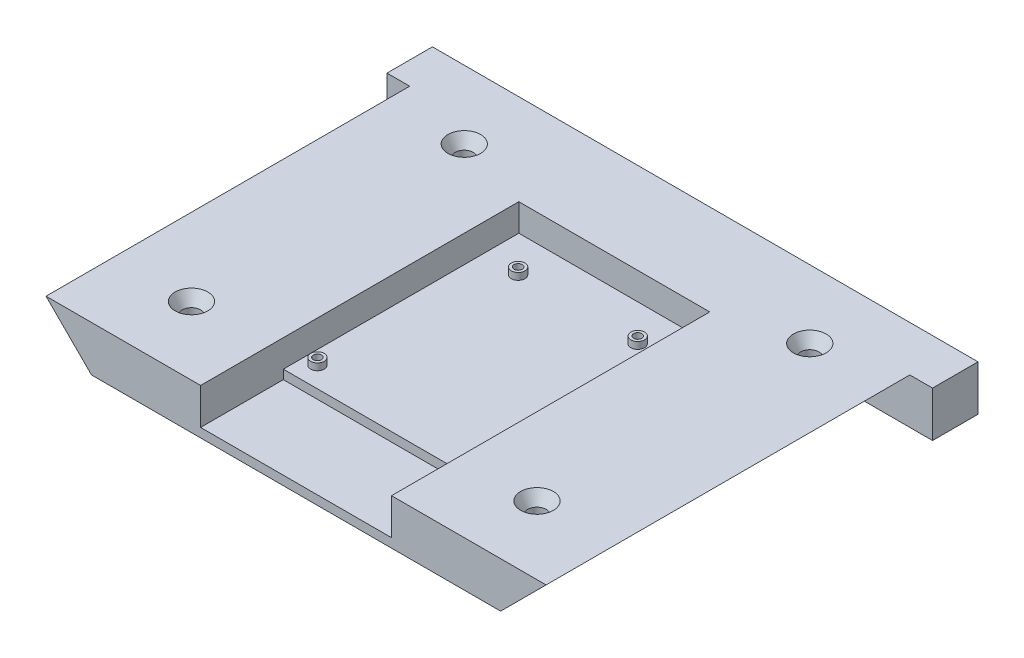
from build123d import *

# Parameters (mm, degrees)
SKETCH1_W                       = 120
SKETCH1_H                       = 90
BODY_DEPTH                      = 10
LEFT_CUT_DEPTH                  = 80
SKETCH5_W                       = 42
SKETCH5_H                       = 70
RFID_ROOM_DEPTH                 = 6
SKETCH12_R                      = 1.5
OUTER_SCREW_HOLE_RFID_DEPTH     = 1.5
SKETCH14_R                      = 0.9
INNER_SCREW_HOLE_RFID_DEPTH     = 3
RFID_UPPER_CUT_DEPTH            = 2
SKETCH17_R                      = 0.9
INNER_SCREW_CUT_DOWN_DEPTH      = 1.5
SKETCH6_R                       = 3.6
OUTER_HOLE_UP_DEPTH             = 2.6
OUTER_HOLE_UP_DRAFT             = -31.607502246
OUTER_HOLE_UP_PROFILE_2_DEPTH   = 2.6
OUTER_HOLE_UP_PROFILE_2_DRAFT   = -31.607502246
OUTER_HOLE_UP_PROFILE_3_DEPTH   = 2.6
OUTER_HOLE_UP_PROFILE_3_DRAFT   = -31.607502246
OUTER_HOLE_UP_PROFILE_4_DEPTH   = 2.6
OUTER_HOLE_UP_PROFILE_4_DRAFT   = -31.607502246
SKETCH7_R                       = 2
INNER_HOLE_DEPTH                = 76.364182474
SKETCH11_R                      = 3.6
OUTER_HOLE_DOWN_DEPTH           = 2.6
OUTER_HOLE_DOWN_DRAFT           = -31.607502246
OUTER_HOLE_DOWN_PROFILE_2_DEPTH = 2.6
OUTER_HOLE_DOWN_PROFILE_2_DRAFT = -31.607502246
OUTER_HOLE_DOWN_PROFILE_3_DEPTH = 2.6
OUTER_HOLE_DOWN_PROFILE_3_DRAFT = -31.607502246
OUTER_HOLE_DOWN_PROFILE_4_DEPTH = 2.6
OUTER_HOLE_DOWN_PROFILE_4_DRAFT = -31.607502246
LOGO_DEPTH                      = 2


with BuildPart() as part:
    # Sketch1 → body (new body)
    with BuildSketch(Plane(origin=(0, 0, 0), x_dir=(1, 0, 0), z_dir=(0, 1, 0))):
        Rectangle(SKETCH1_W, SKETCH1_H)
    extrude(amount=BODY_DEPTH)

    # Sketch4 → left cut (cut)
    with BuildSketch(Plane.XY.offset(45)):
        Polygon((-60, 10), (-60, 0), (-45, 0), (-55, 10), align=None)
    left_cut = extrude(amount=-LEFT_CUT_DEPTH, mode=Mode.SUBTRACT)

    # right cut(mirror): left cut across plane
    add(left_cut.mirror(Plane(origin=(0, 0, 0), x_dir=(0, 0, 1), z_dir=(1, 0, 0))), mode=Mode.SUBTRACT)

    # Sketch5 → rfid room (cut)
    with BuildSketch(Plane(origin=(0, 10, 0), x_dir=(1, 0, 0), z_dir=(0, 1, 0))):
        with Locations((0, -10)):
            Rectangle(SKETCH5_W, SKETCH5_H)
    extrude(amount=-RFID_ROOM_DEPTH, mode=Mode.SUBTRACT)

    # Sketch12 → outer screw hole rfid (add)
    with BuildSketch(Plane(origin=(0, 4, 0), x_dir=(1, 0, 0), z_dir=(0, 1, 0))):
        with Locations(Location((-13.15, 17, 0), (0, 0, 90))):
            Circle(SKETCH12_R)
        with Locations(Location((13.15, 17, 0), (0, 0, 90))):
            Circle(SKETCH12_R)
        with Locations(Location((-18, -22.3, 0), (0, 0, 90))):
            Circle(SKETCH12_R)
        with Locations(Location((18, -22.3, 0), (0, 0, 90))):
            Circle(SKETCH12_R)
    extrude(amount=OUTER_SCREW_HOLE_RFID_DEPTH)

    # Sketch14 → inner screw hole rfid (cut)
    with BuildSketch(Plane(origin=(0, 5.5, 0), x_dir=(1, 0, 0), z_dir=(0, 1, 0))):
        with Locations(Location((18, -22.3, 0), (0, 0, 270))):
            Circle(SKETCH14_R)
        with Locations(Location((-18, -22.3, 0), (0, 0, 270))):
            Circle(SKETCH14_R)
    extrude(amount=-INNER_SCREW_HOLE_RFID_DEPTH, mode=Mode.SUBTRACT)

    # Sketch15 → rfid upper cut (cut)
    with BuildSketch(Plane(origin=(0, 4, 0), x_dir=(1, 0, 0), z_dir=(0, 1, 0))):
        Polygon((-18, -26.8), (-21, -26.8), (-21, -45), (21, -45), (21, -26.8), align=None)
    extrude(amount=-RFID_UPPER_CUT_DEPTH, mode=Mode.SUBTRACT)

    # Sketch17 → inner screw cut down (cut)
    with BuildSketch(Plane(origin=(0, 5.5, 0), x_dir=(1, 0, 0), z_dir=(0, 1, 0))):
        with Locations(Location((-13.15, 17, 0), (0, 0, 270))):
            Circle(SKETCH17_R)
        with Locations(Location((13.15, 17, 0), (0, 0, 270))):
            Circle(SKETCH17_R)
    extrude(amount=-INNER_SCREW_CUT_DOWN_DEPTH, mode=Mode.SUBTRACT)


with BuildPart() as outer_hole_up_tool:
    # Sketch6 → outer hole up (with draft: the straight prism first)
    with BuildSketch(Plane(origin=(0, 10, 0), x_dir=(1, 0, 0), z_dir=(0, 1, 0))):
        with Locations((-38, 30)):
            Circle(SKETCH6_R)
    extrude(amount=-OUTER_HOLE_UP_DEPTH)
    # outer hole up: the draft: its side faces are tilted about the plane it starts from
    outer_hole_up_sides = [outer_hole_up_tool.faces().sort_by_distance(p)[0] for p in [
        (-41.6, 8.7, -30),
    ]]
    draft(outer_hole_up_sides, Plane(origin=(0, 10, 0), x_dir=(1, 0, 0), z_dir=(0, 1, 0)), OUTER_HOLE_UP_DRAFT)


with BuildPart() as part_1:
    add(part.part)

    # outer hole up: cut by outer_hole_up_tool
    add(outer_hole_up_tool.part, mode=Mode.SUBTRACT)


with BuildPart() as outer_hole_up_profile_2_tool:
    # Sketch6 → outer hole up profile 2 (with draft: the straight prism first)
    with BuildSketch(Plane(origin=(0, 10, 0), x_dir=(1, 0, 0), z_dir=(0, 1, 0))):
        with Locations((38, 30)):
            Circle(SKETCH6_R)
    extrude(amount=-OUTER_HOLE_UP_PROFILE_2_DEPTH)
    # outer hole up profile 2: the draft: its side faces are tilted about the plane it starts from
    outer_hole_up_profile_2_sides = [outer_hole_up_profile_2_tool.faces().sort_by_distance(p)[0] for p in [
        (34.4, 8.7, -30),
    ]]
    draft(outer_hole_up_profile_2_sides, Plane(origin=(0, 10, 0), x_dir=(1, 0, 0), z_dir=(0, 1, 0)), OUTER_HOLE_UP_PROFILE_2_DRAFT)


with BuildPart() as part_2:
    add(part_1.part)

    # outer hole up profile 2: cut by outer_hole_up_profile_2_tool
    add(outer_hole_up_profile_2_tool.part, mode=Mode.SUBTRACT)


with BuildPart() as outer_hole_up_profile_3_tool:
    # Sketch6 → outer hole up profile 3 (with draft: the straight prism first)
    with BuildSketch(Plane(origin=(0, 10, 0), x_dir=(1, 0, 0), z_dir=(0, 1, 0))):
        with Locations((-38, -30)):
            Circle(SKETCH6_R)
    extrude(amount=-OUTER_HOLE_UP_PROFILE_3_DEPTH)
    # outer hole up profile 3: the draft: its side faces are tilted about the plane it starts from
    outer_hole_up_profile_3_sides = [outer_hole_up_profile_3_tool.faces().sort_by_distance(p)[0] for p in [
        (-41.6, 8.7, 30),
    ]]
    draft(outer_hole_up_profile_3_sides, Plane(origin=(0, 10, 0), x_dir=(1, 0, 0), z_dir=(0, 1, 0)), OUTER_HOLE_UP_PROFILE_3_DRAFT)


with BuildPart() as part_3:
    add(part_2.part)

    # outer hole up profile 3: cut by outer_hole_up_profile_3_tool
    add(outer_hole_up_profile_3_tool.part, mode=Mode.SUBTRACT)


with BuildPart() as outer_hole_up_profile_4_tool:
    # Sketch6 → outer hole up profile 4 (with draft: the straight prism first)
    with BuildSketch(Plane(origin=(0, 10, 0), x_dir=(1, 0, 0), z_dir=(0, 1, 0))):
        with Locations((38, -30)):
            Circle(SKETCH6_R)
    extrude(amount=-OUTER_HOLE_UP_PROFILE_4_DEPTH)
    # outer hole up profile 4: the draft: its side faces are tilted about the plane it starts from
    outer_hole_up_profile_4_sides = [outer_hole_up_profile_4_tool.faces().sort_by_distance(p)[0] for p in [
        (34.4, 8.7, 30),
    ]]
    draft(outer_hole_up_profile_4_sides, Plane(origin=(0, 10, 0), x_dir=(1, 0, 0), z_dir=(0, 1, 0)), OUTER_HOLE_UP_PROFILE_4_DRAFT)


with BuildPart() as part_4:
    add(part_3.part)

    # outer hole up profile 4: cut by outer_hole_up_profile_4_tool
    add(outer_hole_up_profile_4_tool.part, mode=Mode.SUBTRACT)

    # Sketch7 → inner hole (cut, through all)
    with BuildSketch(Plane(origin=(0, 7.4, 0), x_dir=(1, 0, 0), z_dir=(0, 1, 0))):
        with Locations(Location((-38, 30, 0), (0, 0, 270))):
            Circle(SKETCH7_R)
        with Locations(Location((-38, -30, 0), (0, 0, 270))):
            Circle(SKETCH7_R)
        with Locations(Location((38, 30, 0), (0, 0, 270))):
            Circle(SKETCH7_R)
        with Locations(Location((38, -30, 0), (0, 0, 270))):
            Circle(SKETCH7_R)
    extrude(amount=-INNER_HOLE_DEPTH, mode=Mode.SUBTRACT)


with BuildPart() as outer_hole_down_tool:
    # Sketch11 → outer hole down (with draft: the straight prism first)
    with BuildSketch(Plane.XZ):
        with Locations((-38, 30)):
            Circle(SKETCH11_R)
    extrude(amount=-OUTER_HOLE_DOWN_DEPTH)
    # outer hole down: the draft: its side faces are tilted about the plane it starts from
    outer_hole_down_sides = [outer_hole_down_tool.faces().sort_by_distance(p)[0] for p in [
        (-41.6, 1.3, 30),
    ]]
    draft(outer_hole_down_sides, Plane.XZ, OUTER_HOLE_DOWN_DRAFT)


with BuildPart() as part_5:
    add(part_4.part)

    # outer hole down: cut by outer_hole_down_tool
    add(outer_hole_down_tool.part, mode=Mode.SUBTRACT)


with BuildPart() as outer_hole_down_profile_2_tool:
    # Sketch11 → outer hole down profile 2 (with draft: the straight prism first)
    with BuildSketch(Plane.XZ):
        with Locations((-38, -30)):
            Circle(SKETCH11_R)
    extrude(amount=-OUTER_HOLE_DOWN_PROFILE_2_DEPTH)
    # outer hole down profile 2: the draft: its side faces are tilted about the plane it starts from
    outer_hole_down_profile_2_sides = [outer_hole_down_profile_2_tool.faces().sort_by_distance(p)[0] for p in [
        (-41.6, 1.3, -30),
    ]]
    draft(outer_hole_down_profile_2_sides, Plane.XZ, OUTER_HOLE_DOWN_PROFILE_2_DRAFT)


with BuildPart() as part_6:
    add(part_5.part)

    # outer hole down profile 2: cut by outer_hole_down_profile_2_tool
    add(outer_hole_down_profile_2_tool.part, mode=Mode.SUBTRACT)


with BuildPart() as outer_hole_down_profile_3_tool:
    # Sketch11 → outer hole down profile 3 (with draft: the straight prism first)
    with BuildSketch(Plane.XZ):
        with Locations((38, 30)):
            Circle(SKETCH11_R)
    extrude(amount=-OUTER_HOLE_DOWN_PROFILE_3_DEPTH)
    # outer hole down profile 3: the draft: its side faces are tilted about the plane it starts from
    outer_hole_down_profile_3_sides = [outer_hole_down_profile_3_tool.faces().sort_by_distance(p)[0] for p in [
        (34.4, 1.3, 30),
    ]]
    draft(outer_hole_down_profile_3_sides, Plane.XZ, OUTER_HOLE_DOWN_PROFILE_3_DRAFT)


with BuildPart() as part_7:
    add(part_6.part)

    # outer hole down profile 3: cut by outer_hole_down_profile_3_tool
    add(outer_hole_down_profile_3_tool.part, mode=Mode.SUBTRACT)


with BuildPart() as outer_hole_down_profile_4_tool:
    # Sketch11 → outer hole down profile 4 (with draft: the straight prism first)
    with BuildSketch(Plane.XZ):
        with Locations((38, -30)):
            Circle(SKETCH11_R)
    extrude(amount=-OUTER_HOLE_DOWN_PROFILE_4_DEPTH)
    # outer hole down profile 4: the draft: its side faces are tilted about the plane it starts from
    outer_hole_down_profile_4_sides = [outer_hole_down_profile_4_tool.faces().sort_by_distance(p)[0] for p in [
        (34.4, 1.3, -30),
    ]]
    draft(outer_hole_down_profile_4_sides, Plane.XZ, OUTER_HOLE_DOWN_PROFILE_4_DRAFT)


with BuildPart() as part_8:
    add(part_7.part)

    # outer hole down profile 4: cut by outer_hole_down_profile_4_tool
    add(outer_hole_down_profile_4_tool.part, mode=Mode.SUBTRACT)

    # Sketch9 → logo (cut)
    with BuildSketch(Plane(origin=(0, 0, 0), x_dir=(-1, 0, 0), z_dir=(0, 1, 0))):
        with BuildLine():
            add(Edge.make_bspline(
                [(-11.508531982, 3.68446428), (-11.44999981, 3.917296752), (-11.327044352, 4.247463938), (-11.235327297, 4.418166266)],
                knots=[0, 0, 0, 0, 1, 1, 1, 1], degree=3))
            add(Edge.make_bspline(
                [(-11.235327297, 4.418166266), (-11.143610243, 4.588870747), (-9.975740098, 6.144619886), (-8.640067966, 7.875388488)],
                knots=[1, 1, 1, 1, 2, 2, 2, 2], degree=3))
            add(Edge.make_bspline(
                [(-8.640067966, 7.875388488), (-7.304395833, 9.606156014), (-5.230775634, 12.292237752), (-4.032011596, 13.84446105)],
                knots=[2, 2, 2, 2, 3, 3, 3, 3], degree=3))
            add(Edge.make_bspline(
                [(-4.032011596, 13.84446105), (-2.833256171, 15.396683273), (-1.51359512, 17.184419758), (-1.099434353, 17.817208438)],
                knots=[3, 3, 3, 3, 4, 4, 4, 4], degree=3))
            add(Edge.make_bspline(
                [(-1.099434353, 17.817208438), (-0.685273586, 18.449998732), (-0.346413994, 19.06912384), (-0.346413994, 19.193041771)],
                knots=[4, 4, 4, 4, 5, 5, 5, 5], degree=3))
            add(Edge.make_bspline(
                [(-0.346413994, 19.193041771), (-0.346413994, 19.378762562), (-0.526161851, 19.418153461), (-1.36946955, 19.417230822)],
                knots=[5, 5, 5, 5, 6, 6, 6, 6], degree=3))
            add(Edge.make_bspline(
                [(-1.36946955, 19.417230822), (-1.932148383, 19.416666149), (-3.153107449, 19.257865549), (-4.082714789, 19.064453044)],
                knots=[6, 6, 6, 6, 7, 7, 7, 7], degree=3))
            add(Edge.make_bspline(
                [(-4.082714789, 19.064453044), (-5.01232213, 18.871040538), (-6.214643229, 18.712794384), (-6.754549981, 18.712794384)],
                knots=[7, 7, 7, 7, 8, 8, 8, 8], degree=3))
            add(Edge.make_bspline(
                [(-6.754549981, 18.712794384), (-7.461251031, 18.712794384), (-7.906486558, 18.795231751), (-8.344203165, 19.00712827)],
                knots=[8, 8, 8, 8, 9, 9, 9, 9], degree=3))
            add(Edge.make_bspline(
                [(-8.344203165, 19.00712827), (-8.678609972, 19.169011153), (-9.086095866, 19.489484163), (-9.249737901, 19.719290872)],
                knots=[9, 9, 9, 9, 10, 10, 10, 10], degree=3))
            add(Edge.make_bspline(
                [(-9.249737901, 19.719290872), (-9.413371324, 19.949097582), (-9.579459377, 20.377173304), (-9.618810981, 20.670571632)],
                knots=[10, 10, 10, 10, 11, 11, 11, 11], degree=3))
            add(Edge.make_bspline(
                [(-9.618810981, 20.670571632), (-9.668807929, 21.043356263), (-9.602524292, 21.376190706), (-9.398729668, 21.775666215)],
                knots=[11, 11, 11, 11, 12, 12, 12, 12], degree=3))
            add(Edge.make_bspline(
                [(-9.398729668, 21.775666215), (-9.238334635, 22.09007155), (-8.812159098, 22.606927922), (-8.451672919, 22.924237365)],
                knots=[12, 12, 12, 12, 13, 13, 13, 13], degree=3))
            add(Edge.make_bspline(
                [(-8.451672919, 22.924237365), (-8.091195353, 23.241545462), (-7.455359917, 23.628703544), (-7.038718682, 23.784590481)],
                knots=[13, 13, 13, 13, 14, 14, 14, 14], degree=3))
            add(Edge.make_bspline(
                [(-7.038718682, 23.784590481), (-6.622077447, 23.940475938), (-5.62848607, 24.21055689), (-4.830739759, 24.384769784)],
                knots=[14, 14, 14, 14, 15, 15, 15, 15], degree=3))
            add(Edge.make_bspline(
                [(-4.830739759, 24.384769784), (-3.56951614, 24.660197497), (-2.924887098, 24.852332996), (-0.225448079, 24.849802869)],
                knots=[15, 15, 15, 15, 16, 16, 16, 16], degree=3))
            add(Edge.make_bspline(
                [(-0.225448079, 24.849802869), (2.457213325, 24.847291078), (3.029908773, 24.652454712), (4.310269898, 24.377375546)],
                knots=[16, 16, 16, 16, 17, 17, 17, 17], degree=3))
            add(Edge.make_bspline(
                [(4.310269898, 24.377375546), (5.12519001, 24.202294851), (6.141002252, 23.900221074), (6.567634264, 23.706100171)],
                knots=[17, 17, 17, 17, 18, 18, 18, 18], degree=3))
            add(Edge.make_bspline(
                [(6.567634264, 23.706100171), (6.994266276, 23.511979268), (7.492427084, 23.213948364), (7.674655409, 23.043808017)],
                knots=[18, 18, 18, 18, 19, 19, 19, 19], degree=3))
            add(Edge.make_bspline(
                [(7.674655409, 23.043808017), (7.856883735, 22.87366767), (8.095198215, 22.562990304), (8.204235487, 22.353413573)],
                knots=[19, 19, 19, 19, 20, 20, 20, 20], degree=3))
            add(Edge.make_bspline(
                [(8.204235487, 22.353413573), (8.313281372, 22.143836841), (8.40249212, 21.787573595), (8.40249212, 21.561716634)],
                knots=[20, 20, 20, 20, 21, 21, 21, 21], degree=3))
            add(Edge.make_bspline(
                [(8.40249212, 21.561716634), (8.40249212, 21.335858327), (8.239530491, 20.910927869), (8.040352295, 20.617423498)],
                knots=[21, 21, 21, 21, 22, 22, 22, 22], degree=3))
            add(Edge.make_bspline(
                [(8.040352295, 20.617423498), (7.8411741, 20.323920741), (6.361850098, 18.394183879), (4.75297328, 16.329122051)],
                knots=[22, 22, 22, 22, 23, 23, 23, 23], degree=3))
            add(Edge.make_bspline(
                [(4.75297328, 16.329122051), (3.14408785, 14.264058608), (0.651010051, 11.050461696), (-0.787205349, 9.18779546)],
                knots=[23, 23, 23, 23, 24, 24, 24, 24], degree=3))
            add(Edge.make_bspline(
                [(-0.787205349, 9.18779546), (-2.225420749, 7.325130301), (-3.548647474, 5.599338785), (-3.727714925, 5.352706552)],
                knots=[24, 24, 24, 24, 25, 25, 25, 25], degree=3))
            add(Edge.make_bspline(
                [(-3.727714925, 5.352706552), (-3.906782375, 5.106072167), (-4.018110636, 4.812603861), (-3.975115844, 4.700554283)],
                knots=[25, 25, 25, 25, 26, 26, 26, 26], degree=3))
            add(Edge.make_bspline(
                [(-3.975115844, 4.700554283), (-3.928253933, 4.578438567), (-3.539078722, 4.43596449), (-3.00360753, 4.344891238)],
                knots=[26, 26, 26, 26, 27, 27, 27, 27], degree=3))
            add(Edge.make_bspline(
                [(-3.00360753, 4.344891238), (-2.512276625, 4.261326141), (-1.750807169, 4.158029259), (-1.311454142, 4.115342373)],
                knots=[27, 27, 27, 27, 28, 28, 28, 28], degree=3))
            add(Edge.make_bspline(
                [(-1.311454142, 4.115342373), (-0.872101115, 4.072655486), (0.131506877, 4.103827141), (0.91878871, 4.184623243)],
                knots=[28, 28, 28, 28, 29, 29, 29, 29], degree=3))
            add(Edge.make_bspline(
                [(0.91878871, 4.184623243), (1.706070543, 4.265412885), (2.934100668, 4.483883615), (3.647743585, 4.670112558)],
                knots=[29, 29, 29, 29, 30, 30, 30, 30], degree=3))
            add(Edge.make_bspline(
                [(3.647743585, 4.670112558), (4.361386502, 4.856341501), (5.421450996, 5.205790455), (6.003422364, 5.446662919)],
                knots=[30, 30, 30, 30, 31, 31, 31, 31], degree=3))
            add(Edge.make_bspline(
                [(6.003422364, 5.446662919), (6.585402344, 5.687537536), (7.474400621, 5.953705613), (7.978977919, 6.03814921)],
                knots=[31, 31, 31, 31, 32, 32, 32, 32], degree=3))
            add(Edge.make_bspline(
                [(7.978977919, 6.03814921), (8.665921346, 6.153109893), (9.049903076, 6.149352586), (9.507454821, 6.023191036)],
                knots=[32, 32, 32, 32, 33, 33, 33, 33], degree=3))
            add(Edge.make_bspline(
                [(9.507454821, 6.023191036), (9.843541111, 5.930522274), (10.343837877, 5.648211771), (10.619230198, 5.395830535)],
                knots=[33, 33, 33, 33, 34, 34, 34, 34], degree=3))
            add(Edge.make_bspline(
                [(10.619230198, 5.395830535), (11.038257162, 5.011814354), (11.131395318, 4.817799495), (11.190134196, 4.206512518)],
                knots=[34, 34, 34, 34, 35, 35, 35, 35], degree=3))
            add(Edge.make_bspline(
                [(11.190134196, 4.206512518), (11.231294475, 3.778110588), (11.18712835, 3.299349975), (11.083301785, 3.048706359)],
                knots=[35, 35, 35, 35, 36, 36, 36, 36], degree=3))
            add(Edge.make_bspline(
                [(11.083301785, 3.048706359), (10.985943387, 2.81365826), (10.56112005, 2.305889943), (10.139259495, 1.920332081)],
                knots=[36, 36, 36, 36, 37, 37, 37, 37], degree=3))
            add(Edge.make_bspline(
                [(10.139259495, 1.920332081), (9.71739894, 1.534772067), (8.914338569, 1.002026807), (8.35469142, 0.736450856)],
                knots=[37, 37, 37, 37, 38, 38, 38, 38], degree=3))
            add(Edge.make_bspline(
                [(8.35469142, 0.736450856), (7.795044271, 0.470874904), (6.671977594, 0.031961127), (5.858995348, -0.238913812)],
                knots=[38, 38, 38, 38, 39, 39, 39, 39], degree=3))
            add(Edge.make_bspline(
                [(5.858995348, -0.238913812), (5.046013102, -0.509786598), (3.841090956, -0.848523459), (3.181389622, -0.991665023)],
                knots=[39, 39, 39, 39, 40, 40, 40, 40], degree=3))
            add(Edge.make_bspline(
                [(3.181389622, -0.991665023), (2.245684462, -1.194695266), (1.37689167, -1.403112777), (-0.76972149, -1.403112777)],
                knots=[40, 40, 40, 40, 41, 41, 41, 41], degree=3))
            add(Edge.make_bspline(
                [(-0.76972149, -1.403112777), (-2.918772054, -1.403112777), (-3.784068074, -1.194828763), (-4.720832601, -0.991221467)],
                knots=[41, 41, 41, 41, 42, 42, 42, 42], degree=3))
            add(Edge.make_bspline(
                [(-4.720832601, -0.991221467), (-5.380525323, -0.847836593), (-6.42069439, -0.573141904), (-7.032319417, -0.380789304)],
                knots=[42, 42, 42, 42, 43, 43, 43, 43], degree=3))
            add(Edge.make_bspline(
                [(-7.032319417, -0.380789304), (-7.643935831, -0.188436704), (-8.627725911, 0.189221123), (-9.218516723, 0.458451029)],
                knots=[43, 43, 43, 43, 44, 44, 44, 44], degree=3))
            add(Edge.make_bspline(
                [(-9.218516723, 0.458451029), (-9.809307536, 0.727680935), (-10.442223253, 1.087424265), (-10.624994181, 1.257878977)],
                knots=[44, 44, 44, 44, 45, 45, 45, 45], degree=3))
            add(Edge.make_bspline(
                [(-10.624994181, 1.257878977), (-10.807773722, 1.428335842), (-11.072649888, 1.728690032), (-11.213623196, 1.925338236)],
                knots=[45, 45, 45, 45, 46, 46, 46, 46], degree=3))
            add(Edge.make_bspline(
                [(-11.213623196, 1.925338236), (-11.35458789, 2.121988592), (-11.502571967, 2.502986009), (-11.542466173, 2.772004902)],
                knots=[46, 46, 46, 46, 47, 47, 47, 47], degree=3))
            add(Edge.make_bspline(
                [(-11.542466173, 2.772004902), (-11.582360378, 3.041023796), (-11.567089993, 3.451629655), (-11.508531982, 3.68446428)],
                knots=[47, 47, 47, 47, 48, 48, 48, 48], degree=3))
        make_face()
        with BuildLine():
            add(Edge.make_bspline(
                [(-16.570169623, -5.896335501), (-16.496186198, -5.655366144), (-16.125769531, -5.168360986), (-15.747024346, -4.814086745)],
                knots=[0, 0, 0, 0, 1, 1, 1, 1], degree=3))
            add(Edge.make_bspline(
                [(-15.747024346, -4.814086745), (-15.202750936, -4.304985607), (-14.916696045, -4.148707463), (-14.382456475, -4.06859392)],
                knots=[1, 1, 1, 1, 2, 2, 2, 2], degree=3))
            add(Edge.make_bspline(
                [(-14.382456475, -4.06859392), (-13.801415283, -3.981460996), (-13.556176161, -4.031408421), (-12.635638034, -4.424358165)],
                knots=[2, 2, 2, 2, 3, 3, 3, 3], degree=3))
            add(Edge.make_bspline(
                [(-12.635638034, -4.424358165), (-12.046655897, -4.675776927), (-10.767758938, -5.157846986), (-9.793649577, -5.495623526)],
                knots=[3, 3, 3, 3, 4, 4, 4, 4], degree=3))
            add(Edge.make_bspline(
                [(-9.793649577, -5.495623526), (-8.819540215, -5.833402219), (-7.232040215, -6.26951901), (-6.265871799, -6.464774103)],
                knots=[4, 4, 4, 4, 5, 5, 5, 5], degree=3))
            add(Edge.make_bspline(
                [(-6.265871799, -6.464774103), (-5.299703382, -6.660031349), (-3.599031996, -6.89100347), (-2.486610663, -6.978048113)],
                knots=[5, 5, 5, 5, 6, 6, 6, 6], degree=3))
            add(Edge.make_bspline(
                [(-2.486610663, -6.978048113), (-0.988993204, -7.095233036), (0.03654282, -7.095009105), (1.464500448, -6.977201912)],
                knots=[6, 6, 6, 6, 7, 7, 7, 7], degree=3))
            add(Edge.make_bspline(
                [(1.464500448, -6.977201912), (2.525185059, -6.889681414), (4.171949314, -6.661051959), (5.123975613, -6.469134302)],
                knots=[7, 7, 7, 7, 8, 8, 8, 8], degree=3))
            add(Edge.make_bspline(
                [(5.123975613, -6.469134302), (6.076001913, -6.277216645), (7.471265585, -5.922761536), (8.224578776, -5.681456283)],
                knots=[8, 8, 8, 8, 9, 9, 9, 9], degree=3))
            add(Edge.make_bspline(
                [(8.224578776, -5.681456283), (8.977883355, -5.440151029), (10.150197673, -5.001581761), (10.829725532, -4.706855995)],
                knots=[9, 9, 9, 9, 10, 10, 10, 10], degree=3))
            add(Edge.make_bspline(
                [(10.829725532, -4.706855995), (11.509244778, -4.412132383), (12.263522597, -4.127438304), (12.505893677, -4.07420512)],
                knots=[10, 10, 10, 10, 11, 11, 11, 11], degree=3))
            add(Edge.make_bspline(
                [(12.505893677, -4.07420512), (12.748540365, -4.020911646), (13.226590427, -4.055821229), (13.569713325, -4.151887716)],
                knots=[11, 11, 11, 11, 12, 12, 12, 12], degree=3))
            add(Edge.make_bspline(
                [(13.569713325, -4.151887716), (13.951111233, -4.258672757), (14.407732802, -4.541230876), (14.746738811, -4.880234732)],
                knots=[12, 12, 12, 12, 13, 13, 13, 13], degree=3))
            add(Edge.make_bspline(
                [(14.746738811, -4.880234732), (15.051371379, -5.184865147), (15.375193129, -5.660088078), (15.466350356, -5.936285689)],
                knots=[13, 13, 13, 13, 14, 14, 14, 14], degree=3))
            add(Edge.make_bspline(
                [(15.466350356, -5.936285689), (15.557507582, -6.212483301), (15.599916708, -6.723851743), (15.560599555, -7.072659048)],
                knots=[14, 14, 14, 14, 15, 15, 15, 15], degree=3))
            add(Edge.make_bspline(
                [(15.560599555, -7.072659048), (15.517802857, -7.452366707), (15.325110053, -7.941122403), (15.080413534, -8.290648872)],
                knots=[15, 15, 15, 15, 16, 16, 16, 16], degree=3))
            add(Edge.make_bspline(
                [(15.080413534, -8.290648872), (14.795357721, -8.697826861), (14.392445191, -9.013298561), (13.748599908, -9.333427599)],
                knots=[16, 16, 16, 16, 17, 17, 17, 17], degree=3))
            add(Edge.make_bspline(
                [(13.748599908, -9.333427599), (13.240887574, -9.585871278), (12.145338596, -10.048719856), (11.314045668, -10.361980235)],
                knots=[17, 17, 17, 17, 18, 18, 18, 18], degree=3))
            add(Edge.make_bspline(
                [(11.314045668, -10.361980235), (10.48275274, -10.675240615), (8.963698175, -11.145866496), (7.938368856, -11.407814332)],
                knots=[18, 18, 18, 18, 19, 19, 19, 19], degree=3))
            add(Edge.make_bspline(
                [(7.938368856, -11.407814332), (6.91304815, -11.669762167), (5.343893284, -11.999294163), (4.451363783, -12.140112441)],
                knots=[19, 19, 19, 19, 20, 20, 20, 20], degree=3))
            add(Edge.make_bspline(
                [(4.451363783, -12.140112441), (3.199984524, -12.337542251), (2.390128703, -12.59673401), (-0.275858439, -12.593396573)],
                knots=[20, 20, 20, 20, 21, 21, 21, 21], degree=3))
            add(Edge.make_bspline(
                [(-0.275858439, -12.593396573), (-3.223749132, -12.589697402), (-4.36524707, -12.339742805), (-5.982297377, -12.063437535)],
                knots=[21, 21, 21, 21, 22, 22, 22, 22], degree=3))
            add(Edge.make_bspline(
                [(-5.982297377, -12.063437535), (-7.025334486, -11.885214132), (-8.644589654, -11.528952502), (-9.58063071, -11.271745979)],
                knots=[22, 22, 22, 22, 23, 23, 23, 23], degree=3))
            add(Edge.make_bspline(
                [(-9.58063071, -11.271745979), (-10.516671766, -11.014539457), (-11.949280273, -10.544148272), (-12.764191772, -10.2264308)],
                knots=[23, 23, 23, 23, 24, 24, 24, 24], degree=3))
            add(Edge.make_bspline(
                [(-12.764191772, -10.2264308), (-13.579111884, -9.908715482), (-14.592925971, -9.473356612), (-15.017111965, -9.25896832)],
                knots=[24, 24, 24, 24, 25, 25, 25, 25], degree=3))
            add(Edge.make_bspline(
                [(-15.017111965, -9.25896832), (-15.50850316, -9.01061354), (-15.938106567, -8.656113214), (-16.201044867, -8.282005989)],
                knots=[25, 25, 25, 25, 26, 26, 26, 26], degree=3))
            add(Edge.make_bspline(
                [(-16.201044867, -8.282005989), (-16.487530395, -7.874384444), (-16.627625203, -7.486849959), (-16.659208116, -7.014641487)],
                knots=[26, 26, 26, 26, 27, 27, 27, 27], degree=3))
            add(Edge.make_bspline(
                [(-16.659208116, -7.014641487), (-16.684228122, -6.640529955), (-16.644161661, -6.137291939), (-16.570169623, -5.896335501)],
                knots=[27, 27, 27, 27, 28, 28, 28, 28], degree=3))
        make_face()
        with BuildLine():
            add(Edge.make_bspline(
                [(-20.374080417, -14.759280735), (-20.204659234, -14.425847169), (-19.867737508, -14.003073663), (-19.625392266, -13.819790277)],
                knots=[0, 0, 0, 0, 1, 1, 1, 1], degree=3))
            add(Edge.make_bspline(
                [(-19.625392266, -13.819790277), (-19.383029798, -13.636511197), (-18.917252889, -13.41539205), (-18.590313327, -13.328416308)],
                knots=[1, 1, 1, 1, 2, 2, 2, 2], degree=3))
            add(Edge.make_bspline(
                [(-18.590313327, -13.328416308), (-18.263373765, -13.241440566), (-17.81887032, -13.212652487), (-17.602535549, -13.264445191)],
                knots=[2, 2, 2, 2, 3, 3, 3, 3], degree=3))
            add(Edge.make_bspline(
                [(-17.602535549, -13.264445191), (-17.386200778, -13.316233589), (-16.5702213, -13.629246352), (-15.789243991, -13.960027195)],
                knots=[3, 3, 3, 3, 4, 4, 4, 4], degree=3))
            add(Edge.make_bspline(
                [(-15.789243991, -13.960027195), (-15.008275295, -14.290808038), (-13.471960802, -14.850390592), (-12.375223266, -15.203543024)],
                knots=[4, 4, 4, 4, 5, 5, 5, 5], degree=3))
            add(Edge.make_bspline(
                [(-12.375223266, -15.203543024), (-11.278485731, -15.556691149), (-9.620895263, -16.006155532), (-8.691684109, -16.202345107)],
                knots=[5, 5, 5, 5, 6, 6, 6, 6], degree=3))
            add(Edge.make_bspline(
                [(-8.691684109, -16.202345107), (-7.762472954, -16.398534682), (-6.187289171, -16.662648621), (-5.191260389, -16.78925588)],
                knots=[6, 6, 6, 6, 7, 7, 7, 7], degree=3))
            add(Edge.make_bspline(
                [(-5.191260389, -16.78925588), (-4.051950087, -16.934079082), (-2.333588134, -17.019461467), (-0.558080661, -17.019461467)],
                knots=[7, 7, 7, 7, 8, 8, 8, 8], degree=3))
            add(Edge.make_bspline(
                [(-0.558080661, -17.019461467), (1.197583062, -17.019461467), (2.936348592, -16.93396281), (4.042878812, -16.793226353)],
                knots=[8, 8, 8, 8, 9, 9, 9, 9], degree=3))
            add(Edge.make_bspline(
                [(4.042878812, -16.793226353), (5.021182577, -16.668798117), (6.449932577, -16.439156664), (7.217878812, -16.282908665)],
                knots=[9, 9, 9, 9, 10, 10, 10, 10], degree=3))
            add(Edge.make_bspline(
                [(7.217878812, -16.282908665), (7.985825046, -16.126660666), (9.312643284, -15.803161893), (10.166363783, -15.56402059)],
                knots=[10, 10, 10, 10, 11, 11, 11, 11], degree=3))
            add(Edge.make_bspline(
                [(10.166363783, -15.56402059), (11.020084283, -15.324879287), (12.766334283, -14.707905749), (14.046919339, -14.19296302)],
                knots=[11, 11, 11, 11, 12, 12, 12, 12], degree=3))
            add(Edge.make_bspline(
                [(14.046919339, -14.19296302), (15.771715007, -13.499396397), (16.543149401, -13.258239713), (17.022973687, -13.262614984)],
                knots=[12, 12, 12, 12, 13, 13, 13, 13], degree=3))
            add(Edge.make_bspline(
                [(17.022973687, -13.262614984), (17.442224583, -13.26643904), (17.853922106, -13.381767918), (18.190163425, -13.589571771)],
                knots=[13, 13, 13, 13, 14, 14, 14, 14], degree=3))
            add(Edge.make_bspline(
                [(18.190163425, -13.589571771), (18.475865194, -13.766145834), (18.878045641, -14.131429308), (19.083898709, -14.401309476)],
                knots=[14, 14, 14, 14, 15, 15, 15, 15], degree=3))
            add(Edge.make_bspline(
                [(19.083898709, -14.401309476), (19.348395915, -14.748088481), (19.476639594, -15.114724156), (19.521141615, -15.65141405)],
                knots=[15, 15, 15, 15, 16, 16, 16, 16], degree=3))
            add(Edge.make_bspline(
                [(19.521141615, -15.65141405), (19.555782051, -16.06909312), (19.54313855, -16.574113974), (19.493046862, -16.773684049)],
                knots=[16, 16, 16, 16, 17, 17, 17, 17], degree=3))
            add(Edge.make_bspline(
                [(19.493046862, -16.773684049), (19.442955173, -16.973249818), (19.17928479, -17.383022394), (18.907113634, -17.684291688)],
                knots=[17, 17, 17, 17, 18, 18, 18, 18], degree=3))
            add(Edge.make_bspline(
                [(18.907113634, -17.684291688), (18.548263876, -18.081489665), (18.004136882, -18.410776198), (16.927458415, -18.882306418)],
                knots=[18, 18, 18, 18, 19, 19, 19, 19], degree=3))
            add(Edge.make_bspline(
                [(16.927458415, -18.882306418), (16.110824368, -19.239950393), (14.719737875, -19.781842381), (13.83615701, -20.086513706)],
                knots=[19, 19, 19, 19, 20, 20, 20, 20], degree=3))
            add(Edge.make_bspline(
                [(13.83615701, -20.086513706), (12.952576145, -20.391185032), (11.352656576, -20.860566373), (10.280784017, -21.129585267)],
                knots=[20, 20, 20, 20, 21, 21, 21, 21], degree=3))
            add(Edge.make_bspline(
                [(10.280784017, -21.129585267), (9.208911459, -21.398604161), (7.538169339, -21.750016819), (6.56803045, -21.910506593)],
                knots=[21, 21, 21, 21, 22, 22, 22, 22], degree=3))
            add(Edge.make_bspline(
                [(6.56803045, -21.910506593), (5.597891561, -22.070996366), (4.042138116, -22.266750998), (3.110808228, -22.3455188)],
                knots=[22, 22, 22, 22, 23, 23, 23, 23], degree=3))
            add(Edge.make_bspline(
                [(3.110808228, -22.3455188), (2.17947834, -22.424286601), (0.528476617, -22.488731419), (-0.558080661, -22.488731419)],
                knots=[23, 23, 23, 23, 24, 24, 24, 24], degree=3))
            add(Edge.make_bspline(
                [(-0.558080661, -22.488731419), (-1.644637939, -22.488731419), (-3.295639662, -22.424286601), (-4.22696955, -22.3455188)],
                knots=[24, 24, 24, 24, 25, 25, 25, 25], degree=3))
            add(Edge.make_bspline(
                [(-4.22696955, -22.3455188), (-5.158299438, -22.266750998), (-6.714052883, -22.071538968), (-7.684191772, -21.911716682)],
                knots=[25, 25, 25, 25, 26, 26, 26, 26], degree=3))
            add(Edge.make_bspline(
                [(-7.684191772, -21.911716682), (-8.654330661, -21.751894396), (-10.400580661, -21.378807781), (-11.564747328, -21.082637228)],
                knots=[26, 26, 26, 26, 27, 27, 27, 27], degree=3))
            add(Edge.make_bspline(
                [(-11.564747328, -21.082637228), (-12.728913994, -20.786466676), (-14.506910549, -20.245474719), (-15.515858439, -19.880436707)],
                knots=[27, 27, 27, 27, 28, 28, 28, 28], degree=3))
            add(Edge.make_bspline(
                [(-15.515858439, -19.880436707), (-16.524806328, -19.515398696), (-17.888521538, -18.953460558), (-18.54632807, -18.63168864)],
                knots=[28, 28, 28, 28, 29, 29, 29, 29], degree=3))
            add(Edge.make_bspline(
                [(-18.54632807, -18.63168864), (-19.355348456, -18.235954828), (-19.877581868, -17.874715034), (-20.160260566, -17.515309754)],
                knots=[29, 29, 29, 29, 30, 30, 30, 30], degree=3))
            add(Edge.make_bspline(
                [(-20.160260566, -17.515309754), (-20.488285332, -17.098259414), (-20.589347208, -16.809922147), (-20.630154364, -16.174754199)],
                knots=[30, 30, 30, 30, 31, 31, 31, 31], degree=3))
            add(Edge.make_bspline(
                [(-20.630154364, -16.174754199), (-20.670358629, -15.548952604), (-20.61230877, -15.228115167), (-20.374080417, -14.759280735)],
                knots=[31, 31, 31, 31, 32, 32, 32, 32], degree=3))
        make_face()
    extrude(amount=LOGO_DEPTH, mode=Mode.SUBTRACT)


solid = part_8.part
